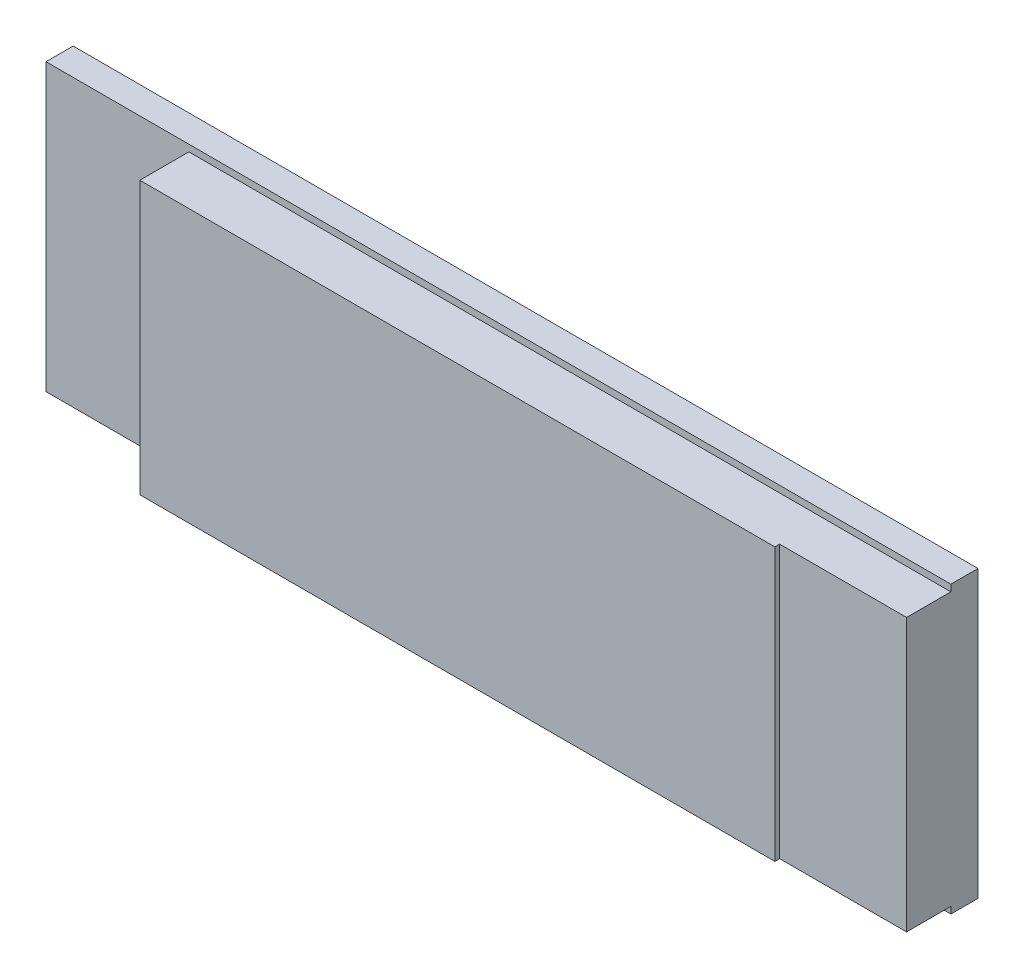
from build123d import *

# Parameters (mm, degrees)
SKETCH_1_W      = 38
SKETCH_1_H      = 12
EXTRUDE_1_DEPTH = 1.14
SKETCH_2_W      = 1.3
SKETCH_2_H      = 2.84
EXTRUDE_2_DEPTH = 1.17
SKETCH_3_W      = 32
SKETCH_3_H      = 11.44
EXTRUDE_3_DEPTH = 1.86
SKETCH_4_W      = 26.67
SKETCH_4_H      = 11.44
EXTRUDE_4_DEPTH = 0.2


with BuildPart() as part:
    # Эскиз1 → Бобышка-Вытянуть1 (new body)
    with BuildSketch(Plane.XY):
        Rectangle(SKETCH_1_W, SKETCH_1_H)
    extrude(amount=EXTRUDE_1_DEPTH)

    # Эскиз2 → Бобышка-Вытянуть2 (add)
    with BuildSketch(Plane(origin=(0, 0, 0), x_dir=(-1, 0, 0), z_dir=(0, 0, -1))):
        with Locations((9.13, -1.3)):
            Rectangle(SKETCH_2_W, SKETCH_2_H)
    extrude(amount=EXTRUDE_2_DEPTH)

    # Эскиз3 → Бобышка-Вытянуть3 (add)
    with BuildSketch(Plane.XY.offset(1.14)):
        with Locations((3, 0)):
            Rectangle(SKETCH_3_W, SKETCH_3_H)
    extrude(amount=EXTRUDE_3_DEPTH)

    # Эскиз4 → Бобышка-Вытянуть4 (add)
    with BuildSketch(Plane.XY.offset(3)):
        with Locations((0.335, 0)):
            Rectangle(SKETCH_4_W, SKETCH_4_H)
    extrude(amount=EXTRUDE_4_DEPTH)


solid = part.part
